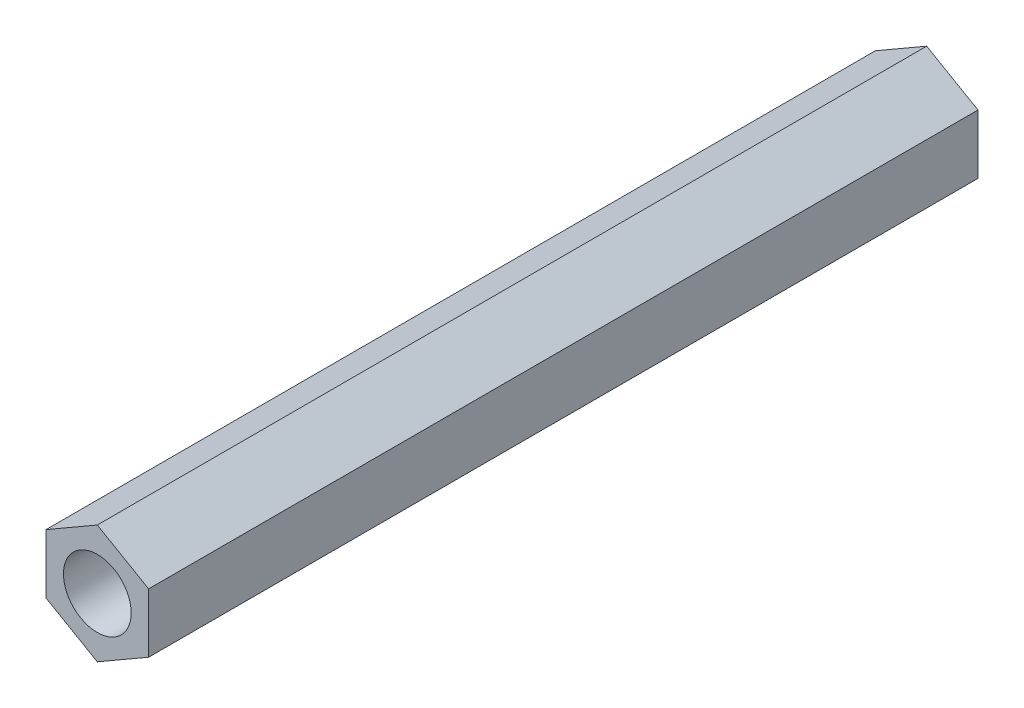
from build123d import *

# Parameters (mm, degrees)
ESQUISSE1_R        = 2
BOSS_EXTRU_1_DEPTH = 49


with BuildPart() as part:
    # Esquisse1 → Boss.-Extru.1 (new body)
    with BuildSketch(Plane.XY):
        Polygon((3.031088913, -1.75), (3.031088913, 1.75), (0, 3.5), (-3.031088913, 1.75), (-3.031088913, -1.75), (0, -3.5), align=None)
        Circle(ESQUISSE1_R, mode=Mode.SUBTRACT)
    extrude(amount=BOSS_EXTRU_1_DEPTH)


solid = part.part
